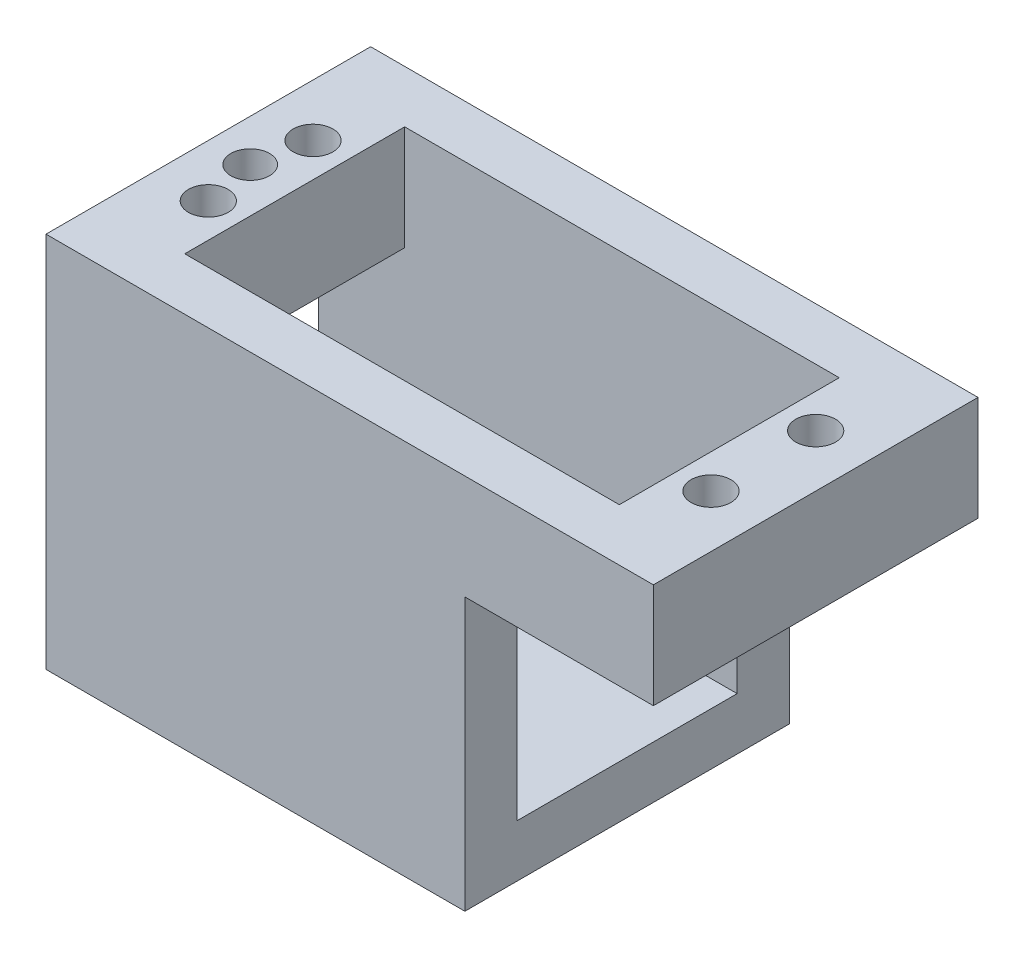
from build123d import *

# Parameters (mm, degrees)
CROQUIS1_W                = 58
CROQUIS1_H                = 31
CROQUIS1_R                = 1.9
CROQUIS1_W_2              = 41.5
CROQUIS1_H_2              = 21
SALIENTE_EXTRUIR1_DEPTH   = 10
CROQUIS2_W                = 40
CROQUIS2_H                = 5
SALIENTE_EXTRUIR2_DEPTH   = 21
CROQUIS3_W                = 40
CROQUIS3_H                = 31
SALIENTE_EXTRUIR3_DEPTH   = 5
CROQUIS4_W                = 24
CROQUIS4_H                = 8
CROQUIS4_R                = 1.85
SALIENTE_EXTRUIR4_DEPTH   = 7.2
CROQUIS5_R                = 1.85
CORTAR_EXTRUIR1_DEPTH     = 55.290791116
CROQUIS6_R                = 3
CORTAR_EXTRUIR2_DEPTH     = 3.5
CROQUIS7_R                = 3.05
SALIENTE_EXTRUIR5_DEPTH   = 0.2
SALIENTE_EXTRUIR5_2_DEPTH = 0.2


with BuildPart() as part:
    # Croquis1 → Saliente-Extruir1 (new body)
    with BuildSketch(Plane(origin=(0, 0, 0), x_dir=(1, 0, 0), z_dir=(0, 1, 0))):
        Rectangle(CROQUIS1_W, CROQUIS1_H)
        with Locations(Location((-24, -5, 0), (0, 0, 270))):
            Circle(CROQUIS1_R, mode=Mode.SUBTRACT)
        with Locations(Location((24, -5, 0), (0, 0, 270))):
            Circle(CROQUIS1_R, mode=Mode.SUBTRACT)
        with Locations(Location((24, 5, 0), (0, 0, 270))):
            Circle(CROQUIS1_R, mode=Mode.SUBTRACT)
        with Locations(Location((-24, 5, 0), (0, 0, 270))):
            Circle(CROQUIS1_R, mode=Mode.SUBTRACT)
        Rectangle(CROQUIS1_W_2, CROQUIS1_H_2, mode=Mode.SUBTRACT)
    extrude(amount=SALIENTE_EXTRUIR1_DEPTH)

    # Croquis2 → Saliente-Extruir2 (add)
    with BuildSketch(Plane.XZ):
        with Locations((-9, 13)):
            Rectangle(CROQUIS2_W, CROQUIS2_H)
        with Locations((-9, -13)):
            Rectangle(CROQUIS2_W, CROQUIS2_H)
    extrude(amount=SALIENTE_EXTRUIR2_DEPTH)

    # Croquis3 → Saliente-Extruir3 (add)
    with BuildSketch(Plane.XZ.offset(21)):
        with Locations((-9, 0)):
            Rectangle(CROQUIS3_W, CROQUIS3_H)
    extrude(amount=SALIENTE_EXTRUIR3_DEPTH)

    # Croquis4 → Saliente-Extruir4 (add)
    with BuildSketch(Plane.XZ.offset(26)):
        with Locations((-17, 0)):
            Rectangle(CROQUIS4_W, CROQUIS4_H)
        with Locations(Location((-25, 0, 0), (0, 0, 270))):
            Circle(CROQUIS4_R, mode=Mode.SUBTRACT)
        with Locations(Location((-15, 0, 0), (0, 0, 270))):
            Circle(CROQUIS4_R, mode=Mode.SUBTRACT)
    extrude(amount=SALIENTE_EXTRUIR4_DEPTH)

    # Croquis5 → Cortar-Extruir1 (cut, through all)
    with BuildSketch(Plane.XZ.offset(33.2)):
        with Locations(Location((-25, 0, 0), (0, 0, 270))):
            Circle(CROQUIS5_R)
        with Locations(Location((-15, 0, 0), (0, 0, 270))):
            Circle(CROQUIS5_R)
    extrude(amount=-CORTAR_EXTRUIR1_DEPTH, mode=Mode.SUBTRACT)

    # Croquis6 → Cortar-Extruir2 (cut)
    with BuildSketch(Plane(origin=(0, -21, 0), x_dir=(1, 0, 0), z_dir=(0, 1, 0))):
        with Locations(Location((-25, 0, 0), (0, 0, 270))):
            Circle(CROQUIS6_R)
        with Locations(Location((-15, 0, 0), (0, 0, 270))):
            Circle(CROQUIS6_R)
    extrude(amount=-CORTAR_EXTRUIR2_DEPTH, mode=Mode.SUBTRACT)


with BuildPart() as body_2:
    # Croquis7 → Saliente-Extruir5 (new body)
    with BuildSketch(Plane(origin=(0, -21, 0), x_dir=(1, 0, 0), z_dir=(0, 1, 0))):
        with Locations(Location((-25, 0, 0), (0, 0, 270))):
            Circle(CROQUIS7_R)
    extrude(amount=-SALIENTE_EXTRUIR5_DEPTH)


with BuildPart() as body_3:
    # Croquis7 → Saliente-Extruir5 2 (new body)
    with BuildSketch(Plane(origin=(0, -21, 0), x_dir=(1, 0, 0), z_dir=(0, 1, 0))):
        with Locations(Location((-15, 0, 0), (0, 0, 270))):
            Circle(CROQUIS7_R)
    extrude(amount=-SALIENTE_EXTRUIR5_2_DEPTH)


solid = Compound([part.part, body_2.part, body_3.part])
